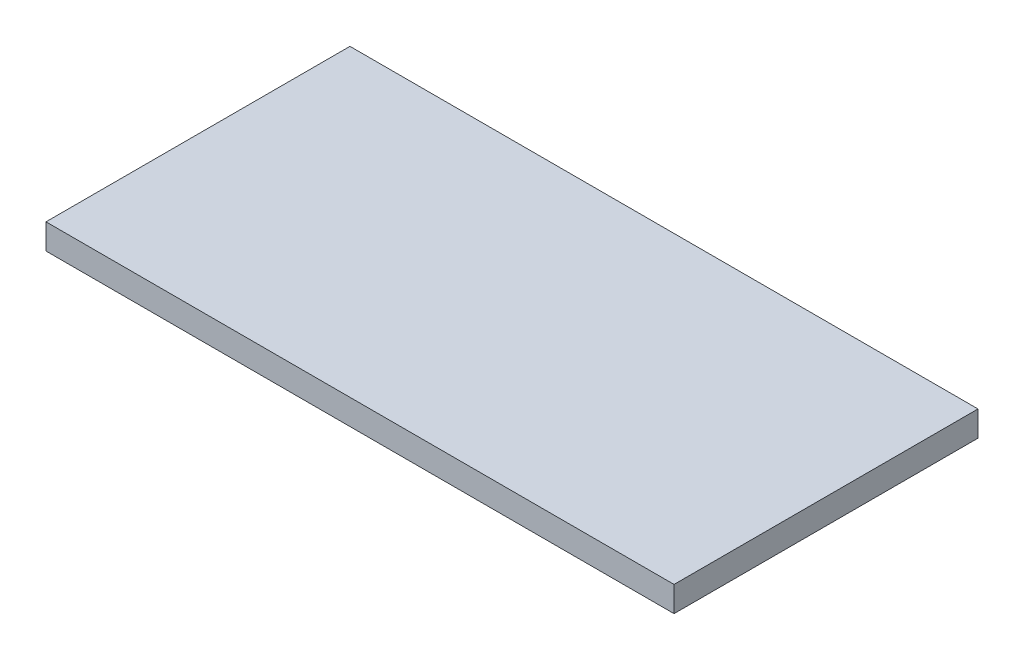
from build123d import *

# Parameters (mm, degrees)
SKETCH1_W           = 124
SKETCH1_H           = 60.01
BOSS_EXTRUDE1_DEPTH = 5


with BuildPart() as part:
    # Sketch1 → Boss-Extrude1 (new body)
    with BuildSketch(Plane(origin=(0, 0, 0), x_dir=(1, 0, 0), z_dir=(0, 1, 0))):
        with Locations((62, -30.005)):
            Rectangle(SKETCH1_W, SKETCH1_H)
    extrude(amount=BOSS_EXTRUDE1_DEPTH)


solid = part.part
